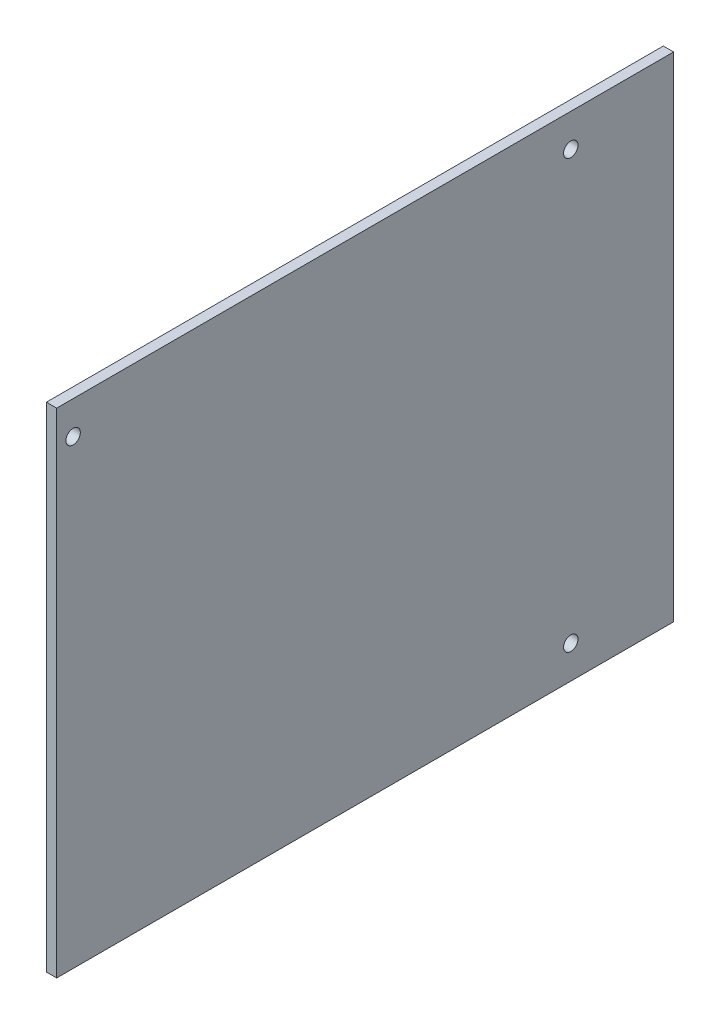
from build123d import *

# Parameters (mm, degrees)
SKETCH1_W           = 150
SKETCH1_H           = 120
SKETCH1_R           = 1.75
BOSS_EXTRUDE1_DEPTH = 2.5


with BuildPart() as part:
    # Sketch1 → Boss-Extrude1 (new body)
    with BuildSketch(Plane(origin=(0, 0, 0), x_dir=(0, 0, -1), z_dir=(1, 0, 0))):
        Rectangle(SKETCH1_W, SKETCH1_H)
        with Locations((50, 52)):
            Circle(SKETCH1_R, mode=Mode.SUBTRACT)
        with Locations((-71, 52)):
            Circle(SKETCH1_R, mode=Mode.SUBTRACT)
        with Locations(Location((50, -52, 0), (0, 0, 180))):
            Circle(SKETCH1_R, mode=Mode.SUBTRACT)
    extrude(amount=BOSS_EXTRUDE1_DEPTH)


solid = part.part
